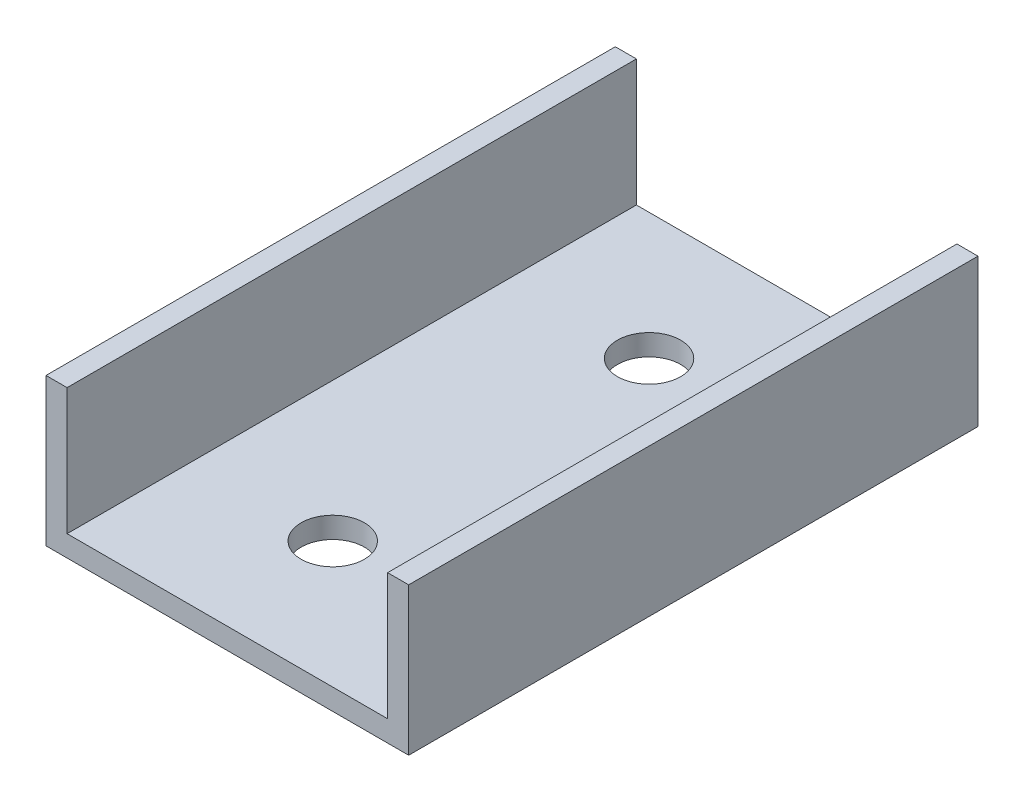
from build123d import *

# Parameters (mm, degrees)
EXTRUDE_641_DEPTH   = 27
SKETCH_3_R          = 1.5
CUT_EXTRUDE_1_DEPTH = 29.964806231


with BuildPart() as part:
    # Sketch 298 → Extrude 641 (new body)
    with BuildSketch(Plane.XY):
        Polygon((-7.6, 7), (-8.6, 7), (-8.6, 0), (8.6, 0), (8.6, 7), (7.6, 7), (7.6, 1), (-7.6, 1), align=None)
    extrude(amount=EXTRUDE_641_DEPTH)

    # Эскиз3 → Вырез-Вытянуть1 (cut, through all)
    with BuildSketch(Plane(origin=(0, 1, 0), x_dir=(1, 0, 0), z_dir=(0, 1, 0))):
        with Locations((-1, -6)):
            Circle(SKETCH_3_R)
        with Locations((-1, -21)):
            Circle(SKETCH_3_R)
    extrude(amount=-CUT_EXTRUDE_1_DEPTH, mode=Mode.SUBTRACT)


solid = part.part
